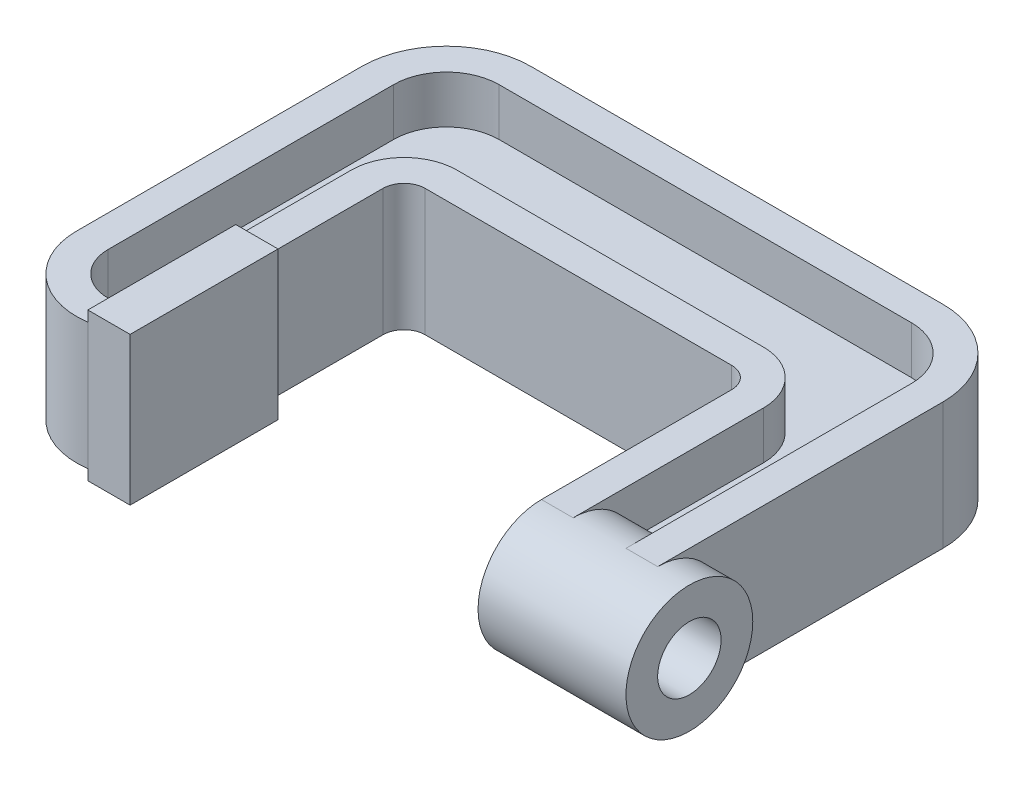
from build123d import *

# Parameters (mm, degrees)
BOSS_EXTRUDE2_DEPTH       = 6
BOSS_EXTRUDE3_DEPTH       = 24
BOSS_EXTRUDE5_START       = 12
SKETCH7_R                 = 24
BOSS_EXTRUDE5_DEPTH       = 56
BOSS_EXTRUDE6_START       = 4
SKETCH4_W                 = 16
SKETCH4_H                 = 56
BOSS_EXTRUDE6_DEPTH       = 56
M24_CLEARANCE_SLOT4_D     = 24
M24_CLEARANCE_SLOT4_DEPTH = 56


with BuildPart() as part:
    # Sketch1 → Boss-Extrude2 (new, symmetric)
    with BuildSketch(Plane(origin=(0, 0, 0), x_dir=(1, 0, 0), z_dir=(0, 1, 0))):
        with BuildLine():
            ThreePointArc((12, 0), (18.202041029, -12.649110641), (32, -15.491933385))
            Line((32, -15.491933385), (32, 0))
            Line((32, 0), (32, 72))
            ThreePointArc((32, 72), (37.857864376, 86.142135624), (52, 92))
            Line((52, 92), (168, 92))
            ThreePointArc((168, 92), (182.142135624, 86.142135624), (188, 72))
            Line((188, 72), (188, 0))
            Line((188, 0), (208, 0))
            Line((208, 0), (208, 108))
            ThreePointArc((208, 108), (202.142135624, 122.142135624), (188, 128))
            Line((188, 128), (32, 128))
            ThreePointArc((32, 128), (17.857864376, 122.142135624), (12, 108))
            Line((12, 108), (12, 0))
        make_face()
    extrude(amount=BOSS_EXTRUDE2_DEPTH, both=True)

    # Sketch1<4> → Boss-Extrude3 (add, symmetric)
    with BuildSketch(Plane(origin=(0, 0, 0), x_dir=(1, 0, 0), z_dir=(0, 1, 0))):
        with BuildLine():
            Line((0, 108), (0, 0))
            ThreePointArc((0, 0), (9.66969722, -21.166010489), (32, -27.712812921))
            Line((32, -27.712812921), (32, -15.491933385))
            ThreePointArc((32, -15.491933385), (18.202041029, -12.649110641), (12, 0))
            Line((12, 0), (12, 108))
            ThreePointArc((12, 108), (17.857864376, 122.142135624), (32, 128))
            Line((32, 128), (188, 128))
            ThreePointArc((188, 128), (202.142135624, 122.142135624), (208, 108))
            Line((208, 108), (208, 0))
            Line((208, 0), (220, 0))
            Line((220, 0), (220, 108))
            ThreePointArc((220, 108), (210.627416998, 130.627416998), (188, 140))
            Line((188, 140), (32, 140))
            ThreePointArc((32, 140), (9.372583002, 130.627416998), (0, 108))
        make_face()
        with BuildLine():
            Line((32, 72), (32, 0))
            Line((32, 0), (44, 0))
            Line((44, 0), (44, 72))
            ThreePointArc((44, 72), (46.343145751, 77.656854249), (52, 80))
            Line((52, 80), (168, 80))
            ThreePointArc((168, 80), (173.656854249, 77.656854249), (176, 72))
            Line((176, 72), (176, 0))
            Line((176, 0), (188, 0))
            Line((188, 0), (188, 72))
            ThreePointArc((188, 72), (182.142135624, 86.142135624), (168, 92))
            Line((168, 92), (52, 92))
            ThreePointArc((52, 92), (37.857864376, 86.142135624), (32, 72))
        make_face()
    extrude(amount=BOSS_EXTRUDE3_DEPTH, both=True)

    # Sketch7 → Boss-Extrude5 (add)
    with BuildSketch(Plane(origin=(220, 0, 0), x_dir=(0, 0, -1), z_dir=(1, 0, 0)).offset(BOSS_EXTRUDE5_START)):
        Circle(SKETCH7_R)
    extrude(amount=-BOSS_EXTRUDE5_DEPTH)

    # Sketch4 → Boss-Extrude6 (add)
    with BuildSketch(Plane(origin=(0, 24, 0), x_dir=(1, 0, 0), z_dir=(0, 1, 0)).offset(BOSS_EXTRUDE6_START)):
        with Locations((40, 0.287187079)):
            Rectangle(SKETCH4_W, SKETCH4_H)
    extrude(amount=-BOSS_EXTRUDE6_DEPTH)

    # M24 Clearance Slot4
    with Locations(Plane(origin=(232, 0, 0), x_dir=(0, 0, -1), z_dir=(1, 0, 0))):
        with Locations((0, 0)):
            Hole(M24_CLEARANCE_SLOT4_D / 2, depth=M24_CLEARANCE_SLOT4_DEPTH)


solid = part.part
